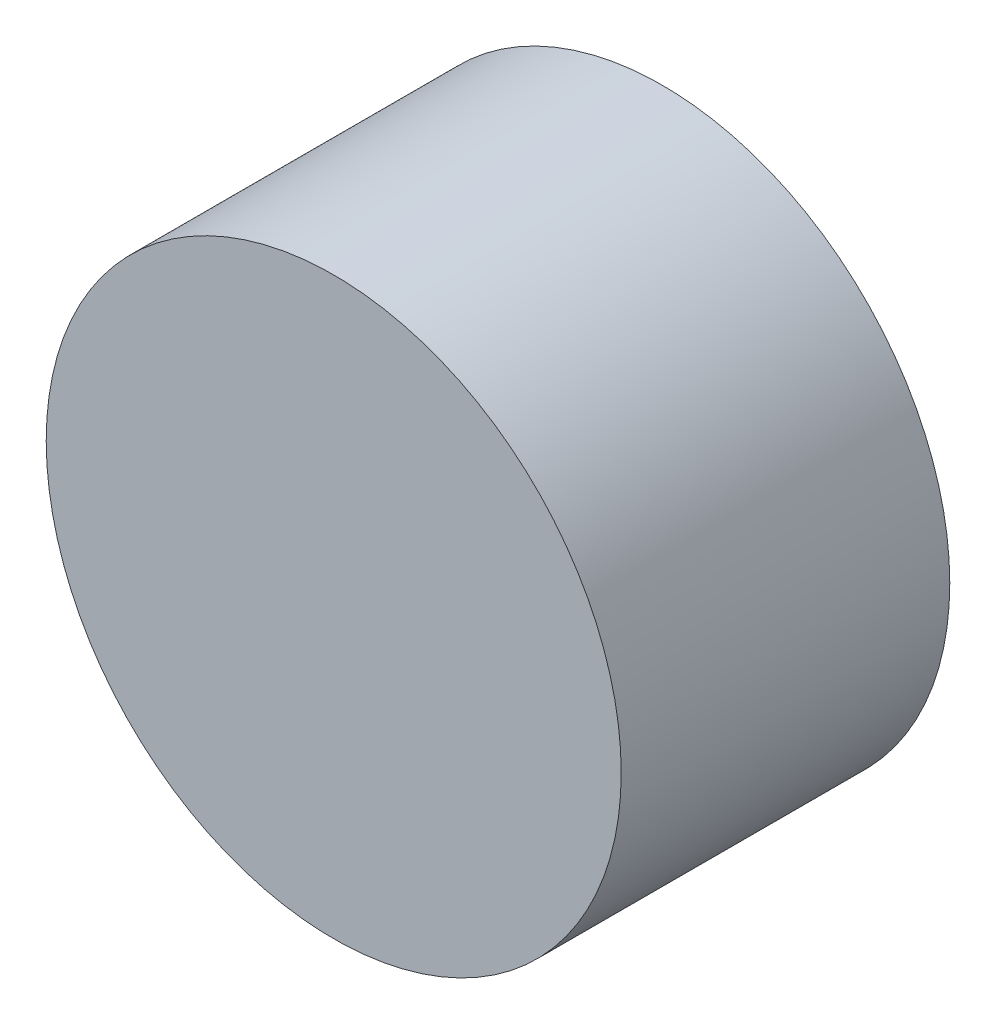
from build123d import *

# Parameters (mm, degrees)
SKETCH1_R           = 5.55625
BOSS_EXTRUDE1_DEPTH = 6.35


with BuildPart() as part:
    # Sketch1 → Boss-Extrude1 (new body)
    with BuildSketch(Plane.XY):
        Circle(SKETCH1_R)
    extrude(amount=BOSS_EXTRUDE1_DEPTH)


solid = part.part
